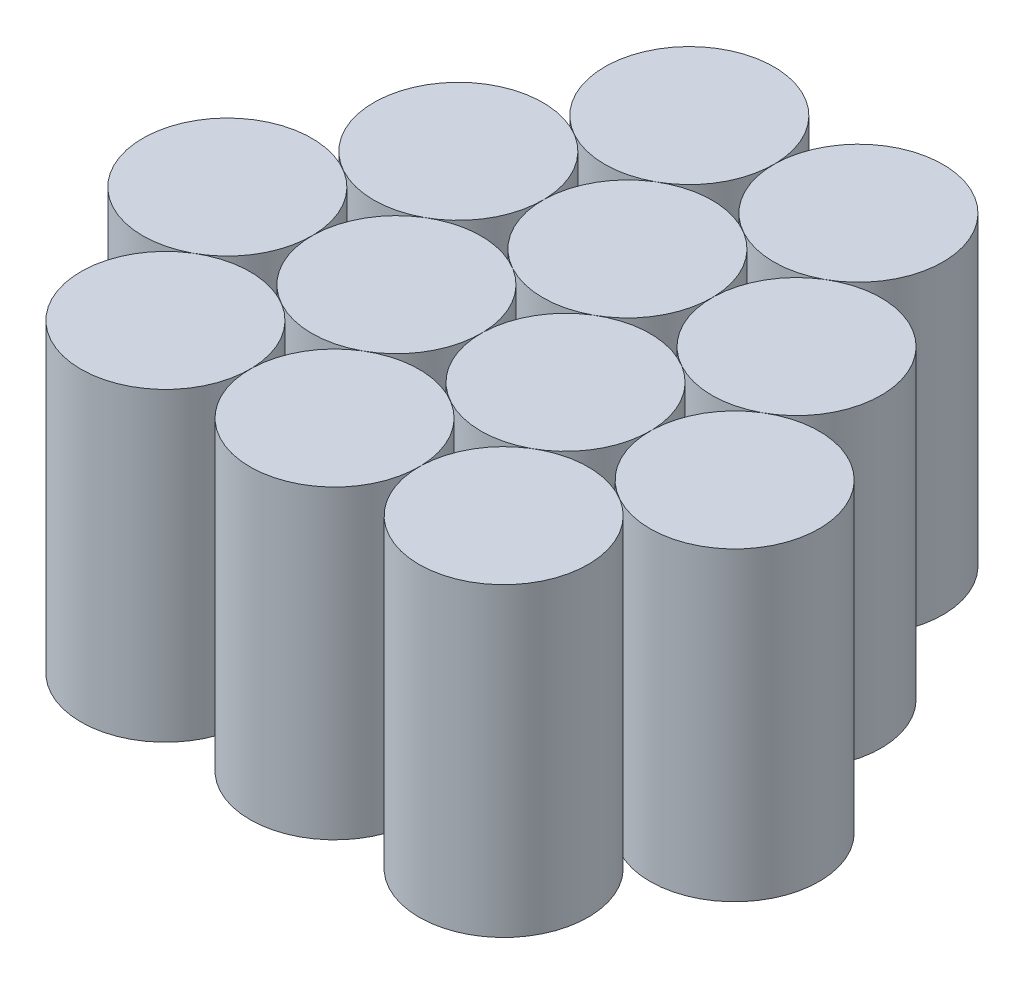
from build123d import *

# Parameters (mm, degrees)
SKETCH1_R              = 17.018
BOSS_EXTRUDE1_DEPTH    = 61.5
BOSS_EXTRUDE1_2_DEPTH  = 61.5
BOSS_EXTRUDE1_3_DEPTH  = 61.5
BOSS_EXTRUDE1_4_DEPTH  = 61.5
BOSS_EXTRUDE1_5_DEPTH  = 61.5
BOSS_EXTRUDE1_6_DEPTH  = 61.5
BOSS_EXTRUDE1_7_DEPTH  = 61.5
BOSS_EXTRUDE1_8_DEPTH  = 61.5
BOSS_EXTRUDE1_9_DEPTH  = 61.5
BOSS_EXTRUDE1_10_DEPTH = 61.5
BOSS_EXTRUDE1_11_DEPTH = 61.5
BOSS_EXTRUDE1_12_DEPTH = 61.5


with BuildPart() as part:
    # Sketch1 → Boss-Extrude1 (new body)
    with BuildSketch(Plane(origin=(0, 0, 0), x_dir=(1, 0, 0), z_dir=(0, 1, 0))):
        with Locations(Location((34.036, -39.301387524, 0), (0, 0, 270))):
            Circle(SKETCH1_R)
    extrude(amount=BOSS_EXTRUDE1_DEPTH)


with BuildPart() as body_2:
    # Sketch1 → Boss-Extrude1 2 (new body)
    with BuildSketch(Plane(origin=(0, 0, 0), x_dir=(1, 0, 0), z_dir=(0, 1, 0))):
        with Locations(Location((51.054, -9.825346881, 0), (0, 0, 270))):
            Circle(SKETCH1_R)
    extrude(amount=BOSS_EXTRUDE1_2_DEPTH)


with BuildPart() as body_3:
    # Sketch1 → Boss-Extrude1 3 (new body)
    with BuildSketch(Plane(origin=(0, 0, 0), x_dir=(1, 0, 0), z_dir=(0, 1, 0))):
        with Locations(Location((34.036, 19.650693762, 0), (0, 0, 270))):
            Circle(SKETCH1_R)
    extrude(amount=BOSS_EXTRUDE1_3_DEPTH)


with BuildPart() as body_4:
    # Sketch1 → Boss-Extrude1 4 (new body)
    with BuildSketch(Plane(origin=(0, 0, 0), x_dir=(1, 0, 0), z_dir=(0, 1, 0))):
        with Locations(Location((17.018, 49.126734405, 0), (0, 0, 270))):
            Circle(SKETCH1_R)
    extrude(amount=BOSS_EXTRUDE1_4_DEPTH)


with BuildPart() as body_5:
    # Sketch1 → Boss-Extrude1 5 (new body)
    with BuildSketch(Plane(origin=(0, 0, 0), x_dir=(1, 0, 0), z_dir=(0, 1, 0))):
        with Locations(Location((-17.018, 49.126734405, 0), (0, 0, 270))):
            Circle(SKETCH1_R)
    extrude(amount=BOSS_EXTRUDE1_5_DEPTH)


with BuildPart() as body_6:
    # Sketch1 → Boss-Extrude1 6 (new body)
    with BuildSketch(Plane(origin=(0, 0, 0), x_dir=(1, 0, 0), z_dir=(0, 1, 0))):
        with Locations(Location((-34.036, 19.650693762, 0), (0, 0, 270))):
            Circle(SKETCH1_R)
    extrude(amount=BOSS_EXTRUDE1_6_DEPTH)


with BuildPart() as body_7:
    # Sketch1 → Boss-Extrude1 7 (new body)
    with BuildSketch(Plane(origin=(0, 0, 0), x_dir=(1, 0, 0), z_dir=(0, 1, 0))):
        with Locations(Location((0, 19.650693762, 0), (0, 0, 270))):
            Circle(SKETCH1_R)
    extrude(amount=BOSS_EXTRUDE1_7_DEPTH)


with BuildPart() as body_8:
    # Sketch1 → Boss-Extrude1 8 (new body)
    with BuildSketch(Plane(origin=(0, 0, 0), x_dir=(1, 0, 0), z_dir=(0, 1, 0))):
        with Locations(Location((-17.018, -9.825346881, 0), (0, 0, 270))):
            Circle(SKETCH1_R)
    extrude(amount=BOSS_EXTRUDE1_8_DEPTH)


with BuildPart() as body_9:
    # Sketch1 → Boss-Extrude1 9 (new body)
    with BuildSketch(Plane(origin=(0, 0, 0), x_dir=(1, 0, 0), z_dir=(0, 1, 0))):
        with Locations(Location((-51.054, -9.825346881, 0), (0, 0, 270))):
            Circle(SKETCH1_R)
    extrude(amount=BOSS_EXTRUDE1_9_DEPTH)


with BuildPart() as body_10:
    # Sketch1 → Boss-Extrude1 10 (new body)
    with BuildSketch(Plane(origin=(0, 0, 0), x_dir=(1, 0, 0), z_dir=(0, 1, 0))):
        with Locations(Location((-34.036, -39.301387524, 0), (0, 0, 270))):
            Circle(SKETCH1_R)
    extrude(amount=BOSS_EXTRUDE1_10_DEPTH)


with BuildPart() as body_11:
    # Sketch1 → Boss-Extrude1 11 (new body)
    with BuildSketch(Plane(origin=(0, 0, 0), x_dir=(1, 0, 0), z_dir=(0, 1, 0))):
        with Locations(Location((0, -39.301387524, 0), (0, 0, 270))):
            Circle(SKETCH1_R)
    extrude(amount=BOSS_EXTRUDE1_11_DEPTH)


with BuildPart() as body_12:
    # Sketch1 → Boss-Extrude1 12 (new body)
    with BuildSketch(Plane(origin=(0, 0, 0), x_dir=(1, 0, 0), z_dir=(0, 1, 0))):
        with Locations(Location((17.018, -9.825346881, 0), (0, 0, 270))):
            Circle(SKETCH1_R)
    extrude(amount=BOSS_EXTRUDE1_12_DEPTH)


solid = Compound([part.part, body_2.part, body_3.part, body_4.part, body_5.part, body_6.part, body_7.part, body_8.part, body_9.part, body_10.part, body_11.part, body_12.part])
